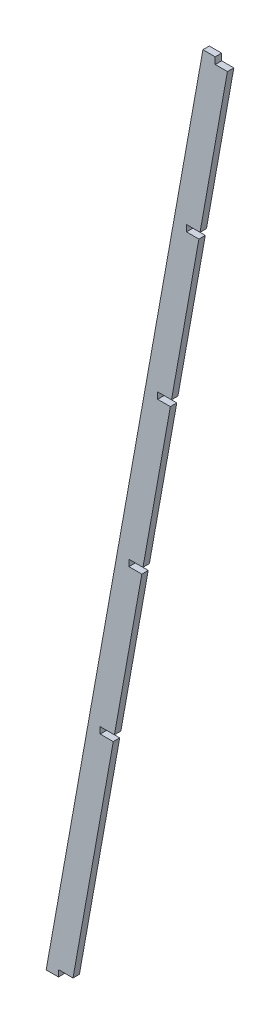
from build123d import *

# Parameters (mm, degrees)
CUT_EXTRUDE1_DEPTH = 5.08


with BuildPart() as part:
    # Sketch1 → Loft1 section 0
    with BuildSketch(Plane(origin=(0, 0, 0), x_dir=(1, 0, 0), z_dir=(0, 1, 0))):
        with BuildLine():
            Line((0, 0), (12.7, 0))
            Line((12.7, 0), (12.7, 3.175))
            Line((12.7, 3.175), (0, 3.175))
            Line((0, 3.175), (0, 0))
        make_face()
    # Sketch2 → Loft1 section 1
    with BuildSketch(Plane(origin=(0, 432.562, 0), x_dir=(1, 0, 0), z_dir=(0, 1, 0))):
        with BuildLine():
            Line((77.47, 0), (90.17, 0))
            Line((90.17, 0), (90.17, 3.175))
            Line((90.17, 3.175), (77.47, 3.175))
            Line((77.47, 3.175), (77.47, 0))
        make_face()
    loft()

    # Sketch3 → Cut-Extrude1 (cut)
    with BuildSketch(Plane.XY):
        Polygon((83.541818167, 432.562), (83.541818167, 429.26), (89.578625954, 429.26), (90.17, 432.562), align=None)
        Polygon((6.071818167, 3.175), (6.071818167, 0), (12.7, 0), (13.26862889, 3.175), align=None)
        Polygon((26.699924676, 117.475), (26.699924676, 114.3), (33.170640047, 114.3), (33.739268937, 117.475), align=None)
        Polygon((69.331344794, 353.695), (69.331344794, 350.52), (75.476629477, 350.52), (76.045258368, 353.695), align=None)
        Polygon((55.120871422, 274.955), (55.120871422, 271.78), (61.374633001, 271.78), (61.943261891, 274.955), align=None)
        Polygon((40.910398049, 193.04), (40.910398049, 196.215), (47.841265414, 196.215), (47.272636524, 193.04), align=None)
    extrude(amount=-CUT_EXTRUDE1_DEPTH, mode=Mode.SUBTRACT)


solid = part.part
